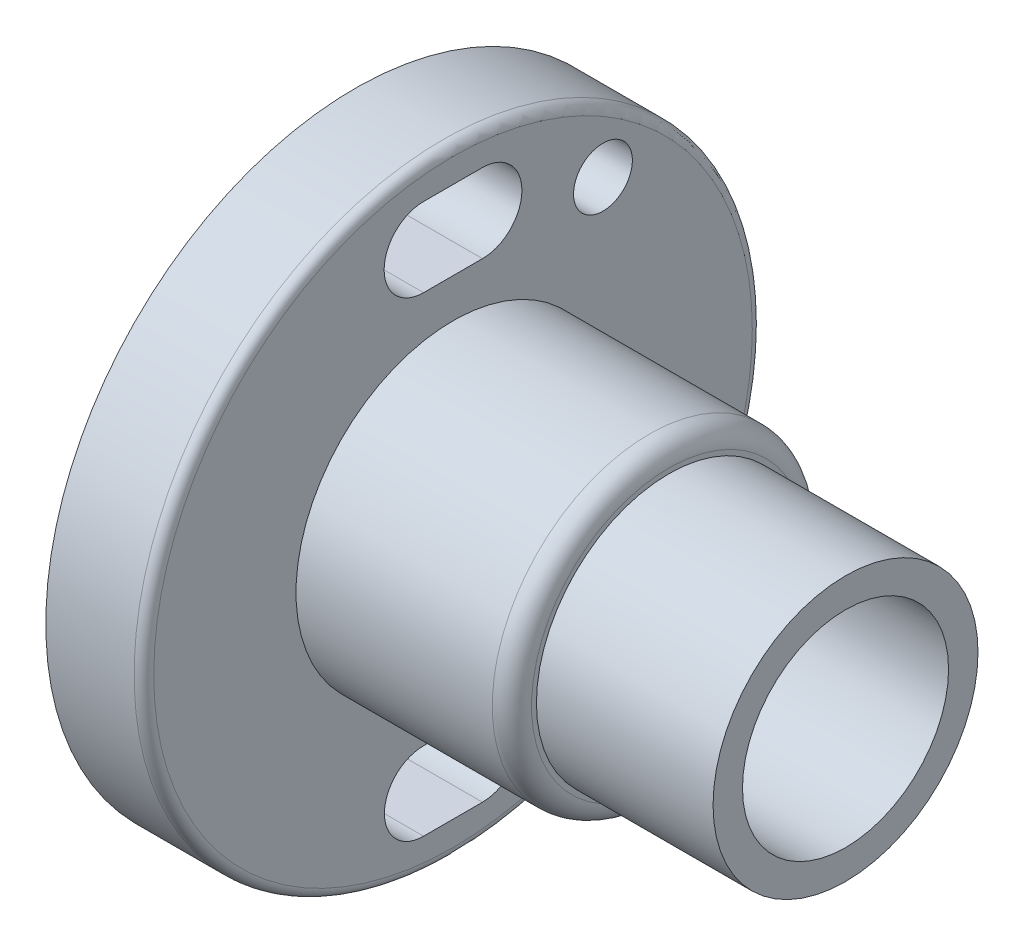
from build123d import *

# Parameters (mm, degrees)
SKETCH1_R           = 31.5
BOSS_EXTRUDE1_DEPTH = 10
SKETCH2_R           = 16
BOSS_EXTRUDE2_DEPTH = 22
SKETCH3_R           = 13.5
BOSS_EXTRUDE3_DEPTH = 18
FILLET1_R           = 1
FILLET6_R           = 2
SKETCH4_R           = 10.5
CUT_EXTRUDE1_DEPTH  = 150
SKETCH5_R           = 12.7
CUT_EXTRUDE2_DEPTH  = 23.5
SKETCH6_R           = 13.95
CUT_EXTRUDE3_DEPTH  = 17.7
SKETCH7_R           = 14.5
CUT_EXTRUDE4_DEPTH  = 15.5
SKETCH8_R           = 16
CUT_EXTRUDE5_DEPTH  = 5.5
SKETCH9_R           = 19.5
CUT_EXTRUDE6_DEPTH  = 2.5
SKETCH10_R          = 3
CUT_EXTRUDE11_DEPTH = 20
SKETCH11_R          = 3
CUT_EXTRUDE12_DEPTH = 20
CUT_EXTRUDE16_DEPTH = 20
CUT_EXTRUDE17_DEPTH = 20


with BuildPart() as part:
    # Sketch1 → Boss-Extrude1 (new body)
    with BuildSketch(Plane(origin=(0, 0, 0), x_dir=(0, 0, -1), z_dir=(1, 0, 0))):
        Circle(SKETCH1_R)
    extrude(amount=BOSS_EXTRUDE1_DEPTH)

    # Sketch2 → Boss-Extrude2 (add)
    with BuildSketch(Plane(origin=(10, 0, 0), x_dir=(0, 0, -1), z_dir=(1, 0, 0))):
        Circle(SKETCH2_R)
    extrude(amount=BOSS_EXTRUDE2_DEPTH)

    # Sketch3 → Boss-Extrude3 (add)
    with BuildSketch(Plane(origin=(32, 0, 0), x_dir=(0, 0, -1), z_dir=(1, 0, 0))):
        Circle(SKETCH3_R)
    extrude(amount=BOSS_EXTRUDE3_DEPTH)

    # Fillet1
    fillet1_edges = [part.edges().sort_by_distance(p)[0] for p in [
        (10, 0, 31.5),
    ]]
    fillet(fillet1_edges, radius=FILLET1_R)

    # Fillet6
    fillet6_edges = [part.edges().sort_by_distance(p)[0] for p in [
        (32, 0, 16),
    ]]
    fillet(fillet6_edges, radius=FILLET6_R)

    # Sketch4 → Cut-Extrude1 (cut)
    with BuildSketch(Plane.ZY):
        Circle(SKETCH4_R)
    extrude(amount=-CUT_EXTRUDE1_DEPTH, mode=Mode.SUBTRACT)

    # Sketch5 → Cut-Extrude2 (cut)
    with BuildSketch(Plane.ZY):
        Circle(SKETCH5_R)
    extrude(amount=-CUT_EXTRUDE2_DEPTH, mode=Mode.SUBTRACT)

    # Sketch6 → Cut-Extrude3 (cut)
    with BuildSketch(Plane.ZY):
        Circle(SKETCH6_R)
    extrude(amount=-CUT_EXTRUDE3_DEPTH, mode=Mode.SUBTRACT)

    # Sketch7 → Cut-Extrude4 (cut)
    with BuildSketch(Plane.ZY):
        Circle(SKETCH7_R)
    extrude(amount=-CUT_EXTRUDE4_DEPTH, mode=Mode.SUBTRACT)

    # Sketch8 → Cut-Extrude5 (cut)
    with BuildSketch(Plane.ZY):
        with Locations(Location((0, 0, 0), (0, 0, 180))):
            Circle(SKETCH8_R)
    extrude(amount=-CUT_EXTRUDE5_DEPTH, mode=Mode.SUBTRACT)

    # Sketch9 → Cut-Extrude6 (cut)
    with BuildSketch(Plane.ZY):
        Circle(SKETCH9_R)
    extrude(amount=-CUT_EXTRUDE6_DEPTH, mode=Mode.SUBTRACT)

    # Sketch10 → Cut-Extrude11 (cut)
    with BuildSketch(Plane(origin=(10, 0, 0), x_dir=(0, 0, -1), z_dir=(1, 0, 0))):
        with Locations((15.279966328, 21.0310694)):
            Circle(SKETCH10_R)
    extrude(amount=-CUT_EXTRUDE11_DEPTH, mode=Mode.SUBTRACT)

    # Sketch11 → Cut-Extrude12 (cut)
    with BuildSketch(Plane.ZY):
        with Locations((-15.28241656, -21.034441854)):
            Circle(SKETCH11_R)
    extrude(amount=-CUT_EXTRUDE12_DEPTH, mode=Mode.SUBTRACT)

    # Sketch12 → Cut-Extrude16 (cut)
    with BuildSketch(Plane.ZY):
        with BuildLine():
            Line((-3, -20.009180996), (3, -20.009180996))
            ThreePointArc((3, -20.009180996), (6.990819004, -24), (3, -27.990819004))
            Line((3, -27.990819004), (-3, -27.990819004))
            ThreePointArc((-3, -27.990819004), (-6.990819004, -24), (-3, -20.009180996))
        make_face()
    extrude(amount=-CUT_EXTRUDE16_DEPTH, mode=Mode.SUBTRACT)

    # Sketch14 → Cut-Extrude17 (cut)
    with BuildSketch(Plane.ZY):
        with BuildLine():
            Line((-3, 28.020849302), (3, 28.020849302))
            ThreePointArc((3, 28.020849302), (7.020849302, 24), (3, 19.979150698))
            Line((3, 19.979150698), (-3, 19.979150698))
            ThreePointArc((-3, 19.979150698), (-7.020849302, 24), (-3, 28.020849302))
        make_face()
    extrude(amount=-CUT_EXTRUDE17_DEPTH, mode=Mode.SUBTRACT)


solid = part.part
